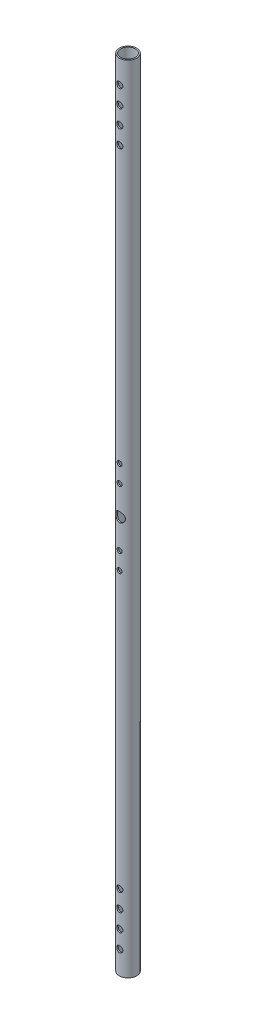
from build123d import *

# Parameters (mm, degrees)
SKETCH_1_R          = 7.5
SKETCH_1_R_2        = 6.375
EXTRUDE_1_DEPTH     = 685
SKETCH_2_R          = 2.65
SKETCH_2_R_2        = 2.15
SKETCH_2_R_3        = 4.15
CUT_EXTRUDE_1_DEPTH = 686.332948281


with BuildPart() as part:
    # 草图1 → 凸台-拉伸1 (new body)
    with BuildSketch(Plane(origin=(0, 0, 0), x_dir=(1, 0, 0), z_dir=(0, 1, 0))):
        with Locations(Location((0, 0, 0), (0, 0, 270))):
            Circle(SKETCH_1_R)
        with Locations(Location((0, 0, 0), (0, 0, 270))):
            Circle(SKETCH_1_R_2, mode=Mode.SUBTRACT)
    extrude(amount=EXTRUDE_1_DEPTH)

    # 草图2 → 切除-拉伸1 (cut, symmetric)
    with BuildSketch(Plane(origin=(12.5, 0, 0), x_dir=(1, 0, 0), z_dir=(0, 0, 1))):
        with Locations((-12.5, 20)):
            Circle(SKETCH_2_R)
        with Locations((-12.5, 35)):
            Circle(SKETCH_2_R)
        with Locations((-12.5, 50)):
            Circle(SKETCH_2_R)
        with Locations((-12.5, 65)):
            Circle(SKETCH_2_R)
        with Locations((-12.5, 302.5)):
            Circle(SKETCH_2_R_2)
        with Locations((-12.5, 317.5)):
            Circle(SKETCH_2_R_2)
        with Locations((-12.5, 342.5)):
            Circle(SKETCH_2_R_3)
        with Locations((-12.5, 367.5)):
            Circle(SKETCH_2_R_2)
        with Locations((-12.5, 382.5)):
            Circle(SKETCH_2_R_2)
    cut_extrude_1 = extrude(amount=CUT_EXTRUDE_1_DEPTH, both=True, mode=Mode.SUBTRACT)

    # 镜向1: 切除-拉伸1 across plane
    add(cut_extrude_1.mirror(Plane.ZX.offset(342.5)), mode=Mode.SUBTRACT)


solid = part.part
